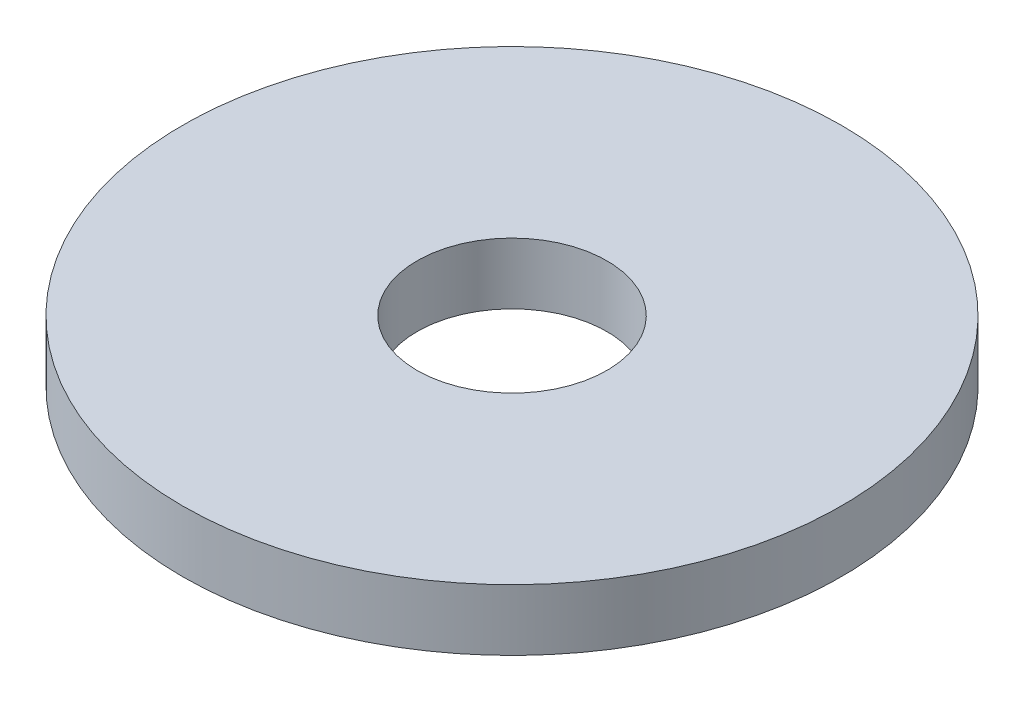
from build123d import *

# Parameters (mm, degrees)
SKETCH1_R           = 31.23
SKETCH1_R_2         = 9
BOSS_EXTRUDE1_DEPTH = 5.81


with BuildPart() as part:
    # Sketch1 → Boss-Extrude1 (new body)
    with BuildSketch(Plane(origin=(0, 0, 0), x_dir=(1, 0, 0), z_dir=(0, 1, 0))):
        with Locations(Location((0, 0, 0), (0, 0, 270))):
            Circle(SKETCH1_R)
        with Locations(Location((0, 0, 0), (0, 0, 270))):
            Circle(SKETCH1_R_2, mode=Mode.SUBTRACT)
    extrude(amount=BOSS_EXTRUDE1_DEPTH)


solid = part.part
